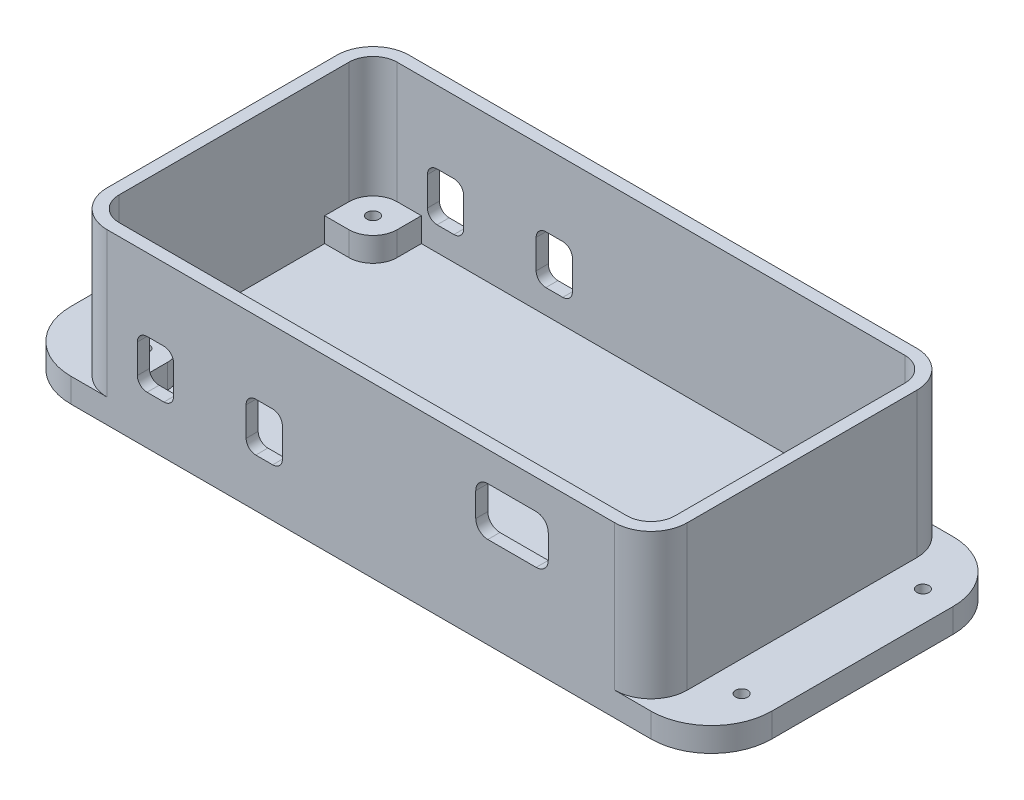
from build123d import *

# Parameters (mm, degrees)
SKETCH1_W           = 147.32
SKETCH1_H           = 63.5
BOSS_EXTRUDE3_DEPTH = 5.08
FILLET4_R           = 12.7
SKETCH4_W           = 121.92
SKETCH4_H           = 63.5
SKETCH4_W_2         = 116.84
SKETCH4_H_2         = 58.42
BOSS_EXTRUDE4_DEPTH = 30.48
SKETCH9_W           = 10.16
SKETCH9_H           = 10.16
BOSS_EXTRUDE5_DEPTH = 5.08
FILLET9_R           = 5.08
SKETCH10_R          = 3.175
CUT_EXTRUDE7_DEPTH  = 163.421034352
FILLET11_R          = 5.08
FILLET12_R          = 7.62
CUT_EXTRUDE8_REACH  = 166.317
SKETCH12_W          = 15.24
SKETCH12_H          = 10.16
FILLET13_R          = 2.54
SKETCH13_W          = 7.62
SKETCH13_H          = 10.16
CUT_EXTRUDE9_DEPTH  = 165.316602935
FILLET14_R          = 2.032
SKETCH11_R          = 3.175
SKETCH11_R_2        = 1.27
BOSS_EXTRUDE7_DEPTH = 5.08
SKETCH15_R          = 1.27
CUT_EXTRUDE10_DEPTH = 2.54
BOSS_EXTRUDE9_START = -2.54
SKETCH16_R          = 3.175
BOSS_EXTRUDE9_DEPTH = 2.54


with BuildPart() as part:
    # Sketch1 → Boss-Extrude3 (new body)
    with BuildSketch(Plane(origin=(0, 0, 0), x_dir=(1, 0, 0), z_dir=(0, 1, 0))):
        with Locations((73.66, 31.75)):
            Rectangle(SKETCH1_W, SKETCH1_H)
    extrude(amount=BOSS_EXTRUDE3_DEPTH)

    # Fillet4
    fillet4_edges = [part.edges().sort_by_distance(p)[0] for p in [
        (147.32, 2.54, -63.5),
        (147.32, 2.54, 0),
        (0, 2.54, 0),
        (0, 2.54, -63.5),
    ]]
    fillet(fillet4_edges, radius=FILLET4_R)

    # Sketch4 → Boss-Extrude4 (add)
    with BuildSketch(Plane(origin=(0, 5.08, 0), x_dir=(1, 0, 0), z_dir=(0, 1, 0))):
        with Locations((73.66, 31.75)):
            Rectangle(SKETCH4_W, SKETCH4_H)
        with Locations((73.66, 31.75)):
            Rectangle(SKETCH4_W_2, SKETCH4_H_2, mode=Mode.SUBTRACT)
    extrude(amount=BOSS_EXTRUDE4_DEPTH)

    # Sketch9 → Boss-Extrude5 (add)
    with BuildSketch(Plane(origin=(0, 5.08, 0), x_dir=(1, 0, 0), z_dir=(0, 1, 0))):
        with Locations((20.32, 55.88)):
            Rectangle(SKETCH9_W, SKETCH9_H)
        with Locations((127, 55.88)):
            Rectangle(SKETCH9_W, SKETCH9_H)
        with Locations((127, 7.62)):
            Rectangle(SKETCH9_W, SKETCH9_H)
        with Locations((20.32, 7.62)):
            Rectangle(SKETCH9_W, SKETCH9_H)
    extrude(amount=BOSS_EXTRUDE5_DEPTH)

    # Fillet9
    fillet9_edges = [part.edges().sort_by_distance(p)[0] for p in [
        (121.92, 7.62, -12.7),
        (25.4, 7.62, -12.7),
        (121.92, 7.62, -50.8),
        (25.4, 7.62, -50.8),
    ]]
    fillet(fillet9_edges, radius=FILLET9_R)

    # Sketch10 → Cut-Extrude7 (cut, through all)
    with BuildSketch(Plane(origin=(0, 10.16, 0), x_dir=(1, 0, 0), z_dir=(0, 1, 0))):
        with Locations((20.32, 55.88)):
            Circle(SKETCH10_R)
        with Locations((127, 55.88)):
            Circle(SKETCH10_R)
        with Locations((20.32, 7.62)):
            Circle(SKETCH10_R)
        with Locations((127, 7.62)):
            Circle(SKETCH10_R)
    extrude(amount=-CUT_EXTRUDE7_DEPTH, mode=Mode.SUBTRACT)

    # Fillet11
    fillet11_edges = [part.edges().sort_by_distance(p)[0] for p in [
        (132.08, 22.86, -2.54),
        (15.24, 22.86, -2.54),
        (132.08, 22.86, -60.96),
        (15.24, 22.86, -60.96),
    ]]
    fillet(fillet11_edges, radius=FILLET11_R)

    # Fillet12
    fillet12_edges = [part.edges().sort_by_distance(p)[0] for p in [
        (134.62, 20.32, 0),
        (134.62, 20.32, -63.5),
        (12.7, 20.32, -63.5),
        (12.7, 20.32, 0),
    ]]
    fillet(fillet12_edges, radius=FILLET12_R)

    # Sketch12 → Cut-Extrude8 (cut, up to next)
    with BuildSketch(Plane.XY, mode=Mode.PRIVATE) as cut_extrude8_sk1:
        with Locations((105.41, 24.257)):
            Rectangle(SKETCH12_W, SKETCH12_H)
    cut_extrude8_tool1 = extrude(cut_extrude8_sk1.sketch, amount=-CUT_EXTRUDE8_REACH, mode=Mode.PRIVATE) & part.part
    add(cut_extrude8_tool1.solids().sort_by_distance((105.41, 24.257, 0))[0], mode=Mode.SUBTRACT)

    # Fillet13
    fillet13_edges = [part.edges().sort_by_distance(p)[0] for p in [
        (97.79, 19.177, -1.27),
        (97.79, 29.337, -1.27),
        (113.03, 29.337, -1.27),
        (113.03, 19.177, -1.27),
    ]]
    fillet(fillet13_edges, radius=FILLET13_R)

    # Sketch13 → Cut-Extrude9 (cut, through all)
    with BuildSketch(Plane.XY):
        with Locations((30.48, 15.24)):
            Rectangle(SKETCH13_W, SKETCH13_H)
        with Locations((53.34, 15.24)):
            Rectangle(SKETCH13_W, SKETCH13_H)
    extrude(amount=-CUT_EXTRUDE9_DEPTH, mode=Mode.SUBTRACT)

    # Fillet14
    fillet14_edges = [part.edges().sort_by_distance(p)[0] for p in [
        (34.29, 10.16, -62.23),
        (57.15, 10.16, -62.23),
        (34.29, 20.32, -62.23),
        (57.15, 20.32, -62.23),
        (26.67, 20.32, -62.23),
        (49.53, 20.32, -62.23),
        (49.53, 10.16, -62.23),
        (26.67, 10.16, -62.23),
        (49.53, 10.16, -1.27),
        (26.67, 10.16, -1.27),
        (49.53, 20.32, -1.27),
        (26.67, 20.32, -1.27),
        (57.15, 20.32, -1.27),
        (34.29, 20.32, -1.27),
        (57.15, 10.16, -1.27),
        (34.29, 10.16, -1.27),
    ]]
    fillet(fillet14_edges, radius=FILLET14_R)

    # Sketch11 → Boss-Extrude7 (add)
    # profile 1 of 4: a face of its own
    with BuildSketch(Plane(origin=(0, 10.16, 0), x_dir=(1, 0, 0), z_dir=(0, 1, 0))):
        with Locations((20.32, 55.88)):
            Circle(SKETCH11_R)
        with Locations((20.32, 55.88)):
            Circle(SKETCH11_R_2, mode=Mode.SUBTRACT)
    # profile 2 of 4: a face of its own
    with BuildSketch(Plane(origin=(0, 10.16, 0), x_dir=(1, 0, 0), z_dir=(0, 1, 0))):
        with Locations((127, 55.88)):
            Circle(SKETCH11_R)
        with Locations((127, 55.88)):
            Circle(SKETCH11_R_2, mode=Mode.SUBTRACT)
    # profile 3 of 4: a face of its own
    with BuildSketch(Plane(origin=(0, 10.16, 0), x_dir=(1, 0, 0), z_dir=(0, 1, 0))):
        with Locations((20.32, 7.62)):
            Circle(SKETCH11_R)
        with Locations((20.32, 7.62)):
            Circle(SKETCH11_R_2, mode=Mode.SUBTRACT)
    # profile 4 of 4: a face of its own
    with BuildSketch(Plane(origin=(0, 10.16, 0), x_dir=(1, 0, 0), z_dir=(0, 1, 0))):
        with Locations((127, 7.62)):
            Circle(SKETCH11_R)
        with Locations((127, 7.62)):
            Circle(SKETCH11_R_2, mode=Mode.SUBTRACT)
    extrude(amount=-BOSS_EXTRUDE7_DEPTH)

    # Sketch15 → Cut-Extrude10 (cut)
    with BuildSketch(Plane(origin=(0, 5.08, 0), x_dir=(1, 0, 0), z_dir=(0, 1, 0))):
        with Locations((6.35, 50.8)):
            Circle(SKETCH15_R)
        with Locations((6.35, 12.7)):
            Circle(SKETCH15_R)
        with Locations((140.97, 12.7)):
            Circle(SKETCH15_R)
        with Locations((140.97, 50.8)):
            Circle(SKETCH15_R)
    extrude(amount=-CUT_EXTRUDE10_DEPTH, mode=Mode.SUBTRACT)

    # Sketch16 → Boss-Extrude9 (add)
    with BuildSketch(Plane.XZ.offset(BOSS_EXTRUDE9_START)):
        with Locations((20.32, -7.62)):
            Circle(SKETCH16_R)
        with Locations((127, -7.62)):
            Circle(SKETCH16_R)
        with Locations((20.32, -55.88)):
            Circle(SKETCH16_R)
        with Locations((127, -55.88)):
            Circle(SKETCH16_R)
    extrude(amount=BOSS_EXTRUDE9_DEPTH)


solid = part.part
